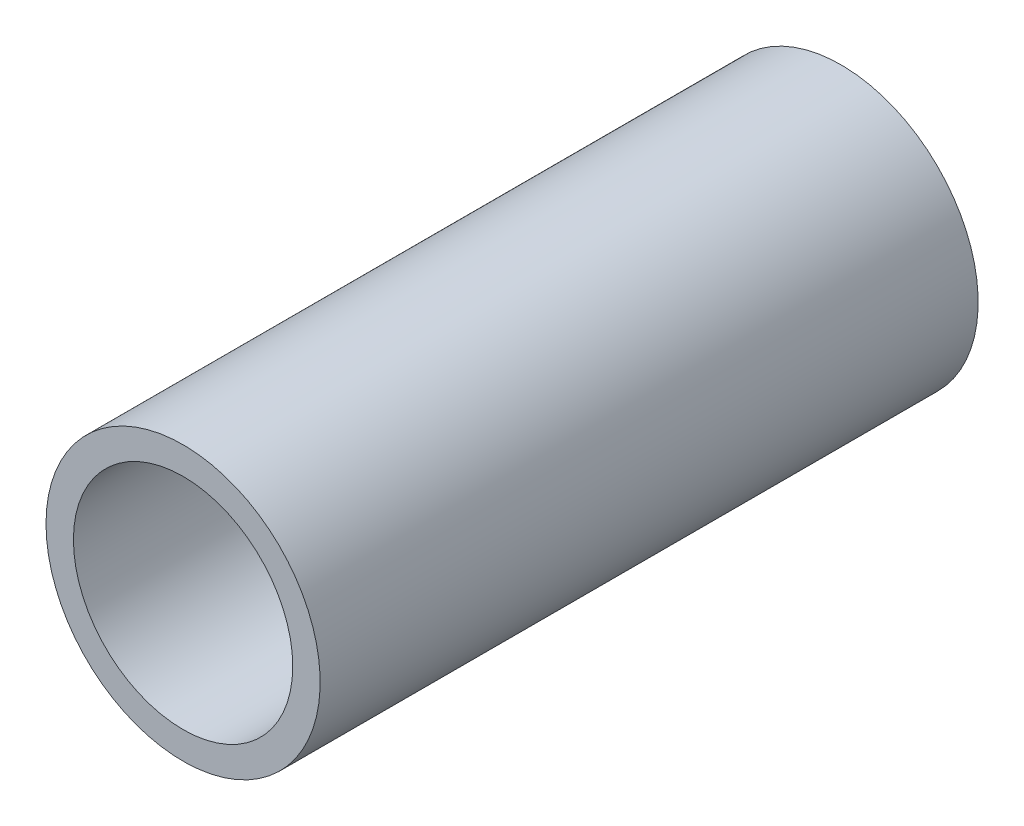
from build123d import *

# Parameters (mm, degrees)
SKETCH1_R           = 3.96875
SKETCH1_R_2         = 3.175
BOSS_EXTRUDE1_DEPTH = 9.525


with BuildPart() as part:
    # Sketch1 → Boss-Extrude1 (new, symmetric)
    with BuildSketch(Plane.XY):
        Circle(SKETCH1_R)
        Circle(SKETCH1_R_2, mode=Mode.SUBTRACT)
    extrude(amount=BOSS_EXTRUDE1_DEPTH, both=True)


solid = part.part
